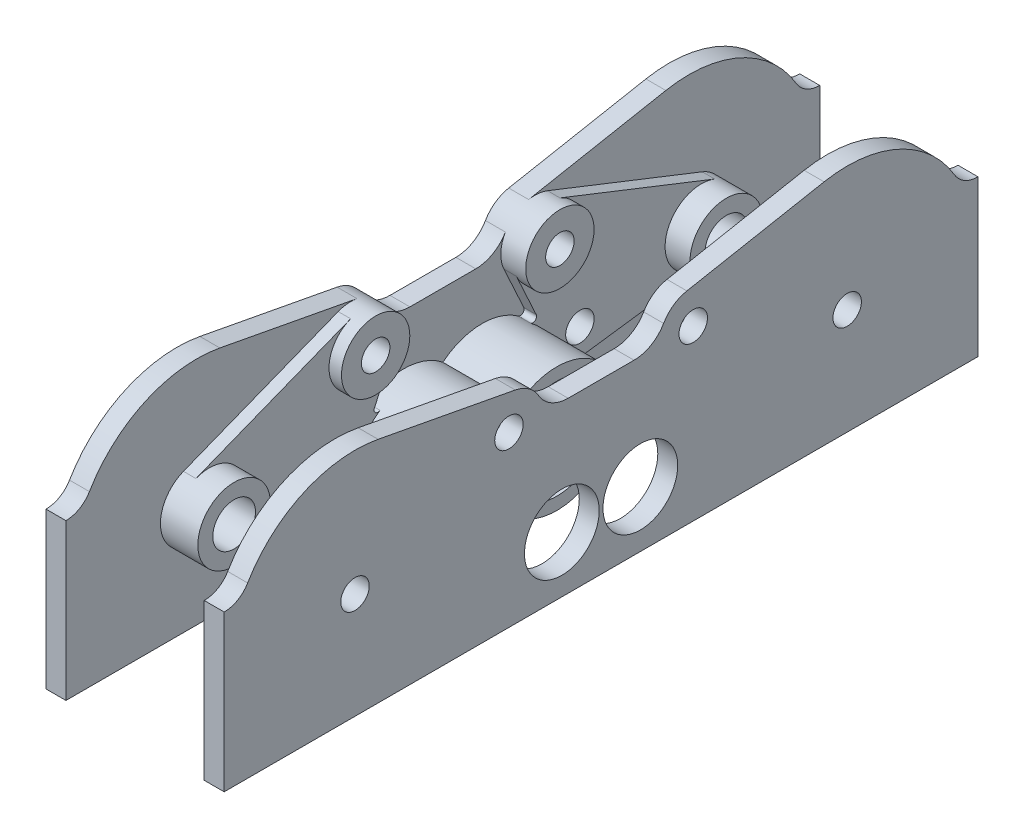
from build123d import *

# Parameters (mm, degrees)
SKETCH1_R                       = 2.286
BOSS_EXTRUDE1_DEPTH             = 3.2
SKETCH4_R                       = 5.486
SKETCH4_R_2                     = 2.286
BOSS_EXTRUDE2_DEPTH             = 4
SKETCH5_R                       = 5.829
SKETCH5_R_2                     = 3.429
EXTRUDE_THIN2_DEPTH             = 6
BOSS_EXTRUDE3_START             = -25.4
BOSS_EXTRUDE3_DEPTH             = 3.2
SKETCH8_R                       = 2.286
CUT_EXTRUDE1_DEPTH              = 106.095956154
EXTRUDE_THIN3_START             = 4
SKETCH9_R                       = 5.286
SKETCH9_R_2                     = 2.286
EXTRUDE_THIN3_DEPTH             = 4
SKETCH10_R                      = 2.286
CUT_EXTRUDE2_DEPTH              = 12
SKETCH13_R                      = 2.286
BOSS_EXTRUDE6_DEPTH             = 2
EXTRUDE_THIN5_DEPTH             = 12
EXTRUDE_THIN5_DIRECTION_2_REACH = 107.096
FILLET2_R                       = 0.6
SKETCH15_R                      = 6
CUT_EXTRUDE3_DEPTH              = 6


with BuildPart() as part:
    # Sketch1 → Boss-Extrude1 (new body)
    with BuildSketch(Plane(origin=(0, 0, 0), x_dir=(0, 0, -1), z_dir=(1, 0, 0))):
        with BuildLine():
            Line((-39.5, 10.1095372), (-39.5, -3.069482786))
            ThreePointArc((-39.5, -3.069482786), (-33.2, 0), (-26.9, -3.069482786))
            Line((-26.9, -3.069482786), (-26.9, -12.930517214))
            ThreePointArc((-26.9, -12.930517214), (-33.2, -16), (-39.5, -12.930517214))
            Line((-39.5, -12.930517214), (-39.5, -17))
            Line((-39.5, -17), (21, -17))
            Line((21, -17), (21, 8))
            ThreePointArc((21, 8), (18.829392145, 8.576436253), (17.230769231, 10.153846154))
            ThreePointArc((17.230769231, 10.153846154), (8.263700567, 18.212941908), (-3.706342027, 19.653575471))
            Line((-3.706342027, 19.653575471), (-25.728736895, 15.500512952))
            ThreePointArc((-25.728736895, 15.500512952), (-27.885324384, 14.584664267), (-29.463102642, 12.8525372))
            ThreePointArc((-29.463102642, 12.8525372), (-31.471118008, 10.844521835), (-34.214118008, 10.1095372))
            Line((-34.214118008, 10.1095372), (-39.5, 10.1095372))
        make_face()
        with Locations((-24.712087277, 10.1095372)):
            Circle(SKETCH1_R, mode=Mode.SUBTRACT)
        Circle(SKETCH1_R, mode=Mode.SUBTRACT)
    extrude(amount=BOSS_EXTRUDE1_DEPTH)

    # Mirror1: part across plane


with BuildPart() as part_1:
    add(part.part)
    add(part.part.mirror(Plane(origin=(3.2, 0, 39.5), x_dir=(1, 0, 0), z_dir=(0, 0, 1))))

    # Sketch4 → Boss-Extrude2 (add)
    # profile 1 of 2: a face of its own
    with BuildSketch(Plane(origin=(3.2, 0, 0), x_dir=(0, 0, -1), z_dir=(1, 0, 0))):
        with Locations((-54.287912723, 10.1095372)):
            Circle(SKETCH4_R)
        with Locations((-54.287912723, 10.1095372)):
            Circle(SKETCH4_R_2, mode=Mode.SUBTRACT)
    # profile 2 of 2: a face of its own
    with BuildSketch(Plane(origin=(3.2, 0, 0), x_dir=(0, 0, -1), z_dir=(1, 0, 0))):
        with Locations(Location((-24.712087277, 10.1095372, 0), (0, 0, 150))):
            Circle(SKETCH4_R)
        with Locations((-24.712087277, 10.1095372)):
            Circle(SKETCH4_R_2, mode=Mode.SUBTRACT)
    extrude(amount=BOSS_EXTRUDE2_DEPTH)

    # Sketch5 → Extrude-Thin2 (add)
    # profile 1 of 2: a face of its own
    with BuildSketch(Plane(origin=(3.2, 0, 0), x_dir=(0, 0, -1), z_dir=(1, 0, 0))):
        with Locations((-79, 0)):
            Circle(SKETCH5_R)
        with Locations((-79, 0)):
            Circle(SKETCH5_R_2, mode=Mode.SUBTRACT)
    # profile 2 of 2: a face of its own
    with BuildSketch(Plane(origin=(3.2, 0, 0), x_dir=(0, 0, -1), z_dir=(1, 0, 0))):
        Circle(SKETCH5_R)
        Circle(SKETCH5_R_2, mode=Mode.SUBTRACT)
    extrude(amount=EXTRUDE_THIN2_DEPTH)

    # Sketch10 → Cut-Extrude2 (cut)
    with BuildSketch(Plane.ZY):
        with Locations((19.5, -4.3)):
            Circle(SKETCH10_R)
        with Locations((59.5, -4.3)):
            Circle(SKETCH10_R)
    extrude(amount=-CUT_EXTRUDE2_DEPTH, mode=Mode.SUBTRACT)

    # Sketch13 → Boss-Extrude6 (add)
    with BuildSketch(Plane(origin=(3.2, 0, 0), x_dir=(0, 0, -1), z_dir=(1, 0, 0))):
        with BuildLine():
            Line((-56.299700955, 15.213349903), (-81.137570836, 5.422917289))
            ThreePointArc((-81.137570836, 5.422917289), (-75.719958796, 4.818565212), (-73.171, 0))
            ThreePointArc((-73.171, 0), (-75.166478454, -4.391053809), (-79.786664284, -5.775673147))
            Line((-79.786664284, -5.775673147), (-60.06681935, -8.461576123))
            ThreePointArc((-60.06681935, -8.461576123), (-57.478432006, -7.981475634), (-55.684260226, -6.055029907))
            Line((-55.684260226, -6.055029907), (-49.30382977, 7.817133851))
            ThreePointArc((-49.30382977, 7.817133851), (-58.273466254, 6.33971505), (-56.299700955, 15.213349903))
        make_face()
        with Locations(Location((-59.5, -4.3, 0), (0, 0, 180))):
            Circle(SKETCH13_R, mode=Mode.SUBTRACT)
    boss_extrude6 = extrude(amount=BOSS_EXTRUDE6_DEPTH)

    # Mirror3: Boss-Extrude6 across plane
    add(boss_extrude6.mirror(Plane(origin=(0, 0, 39.5), x_dir=(1, 0, 0), z_dir=(0, 0, -1))))

    # Sketch14 → Extrude-Thin5 (add)
    with BuildSketch(Plane(origin=(3.2, 0, 0), x_dir=(0, 0, -1), z_dir=(1, 0, 0))):
        with BuildLine():
            ThreePointArc((-39.5, -0.234048674), (-31.717710122, 1.889530662), (-24.9, -2.422366093))
            Line((-24.9, -2.422366093), (-24.9, -13.577633907))
            ThreePointArc((-24.9, -13.577633907), (-31.717710122, -17.889530662), (-39.5, -15.765951326))
            ThreePointArc((-39.5, -15.765951326), (-47.282289878, -17.889530662), (-54.1, -13.577633907))
            Line((-54.1, -13.577633907), (-54.1, -2.422366093))
            ThreePointArc((-54.1, -2.422366093), (-47.282289878, 1.889530662), (-39.5, -0.234048674))
        make_face()
        with BuildLine():
            ThreePointArc((-39.5, -3.069482786), (-33.2, 0), (-26.9, -3.069482786))
            Line((-26.9, -3.069482786), (-26.9, -12.930517214))
            ThreePointArc((-26.9, -12.930517214), (-33.2, -16), (-39.5, -12.930517214))
            ThreePointArc((-39.5, -12.930517214), (-45.8, -16), (-52.1, -12.930517214))
            Line((-52.1, -12.930517214), (-52.1, -3.069482786))
            ThreePointArc((-52.1, -3.069482786), (-45.8, 0), (-39.5, -3.069482786))
        make_face(mode=Mode.SUBTRACT)
    extrude(amount=EXTRUDE_THIN5_DEPTH)

    # Extrude-Thin5 direction 2: up to this face of the body (flat: up to its plane)
    extrude_thin5_direction_2_end = Plane(part_1.part.faces().sort_by_distance((0, 0.243251913, 39.5))[0])
    # Sketch14 → Extrude-Thin5 direction 2 (add, up to the picked face)
    with BuildSketch(Plane(origin=(3.2, 0, 0), x_dir=(0, 0, -1), z_dir=(1, 0, 0)), mode=Mode.PRIVATE) as extrude_thin5_direction_2_sk1:
        with BuildLine():
            ThreePointArc((-39.5, -0.234048674), (-31.717710122, 1.889530662), (-24.9, -2.422366093))
            Line((-24.9, -2.422366093), (-24.9, -13.577633907))
            ThreePointArc((-24.9, -13.577633907), (-31.717710122, -17.889530662), (-39.5, -15.765951326))
            ThreePointArc((-39.5, -15.765951326), (-47.282289878, -17.889530662), (-54.1, -13.577633907))
            Line((-54.1, -13.577633907), (-54.1, -2.422366093))
            ThreePointArc((-54.1, -2.422366093), (-47.282289878, 1.889530662), (-39.5, -0.234048674))
        make_face()
        with BuildLine():
            ThreePointArc((-39.5, -3.069482786), (-33.2, 0), (-26.9, -3.069482786))
            Line((-26.9, -3.069482786), (-26.9, -12.930517214))
            ThreePointArc((-26.9, -12.930517214), (-33.2, -16), (-39.5, -12.930517214))
            ThreePointArc((-39.5, -12.930517214), (-45.8, -16), (-52.1, -12.930517214))
            Line((-52.1, -12.930517214), (-52.1, -3.069482786))
            ThreePointArc((-52.1, -3.069482786), (-45.8, 0), (-39.5, -3.069482786))
        make_face(mode=Mode.SUBTRACT)
    extrude_thin5_direction_2_tool1 = split(extrude(extrude_thin5_direction_2_sk1.sketch, amount=-EXTRUDE_THIN5_DIRECTION_2_REACH, mode=Mode.PRIVATE), bisect_by=extrude_thin5_direction_2_end, keep=Keep.BOTH, mode=Mode.PRIVATE)
    add(extrude_thin5_direction_2_tool1.solids().sort_by(Axis((3.2, 1.539514, 31.770172), (-1, 0, 0)))[0])

    # Fillet2
    fillet2_edges = [part_1.edges().sort_by_distance(p)[0] for p in [
        (4.2, -2.067620911, 53.850271942),
        (4.2, -2.610573073, 54.1),
        (4.2, -2.610573073, 24.9),
        (4.2, -2.067620911, 25.149728058),
    ]]
    fillet(fillet2_edges, radius=FILLET2_R)


with BuildPart() as body_2:
    # Sketch7 → Boss-Extrude3 (new body)
    with BuildSketch(Plane.ZY.offset(BOSS_EXTRUDE3_START)):
        with BuildLine():
            Line((25.728736895, 15.500512952), (3.706342027, 19.653575471))
            ThreePointArc((3.706342027, 19.653575471), (-8.263700567, 18.212941908), (-17.230769231, 10.153846154))
            ThreePointArc((-17.230769231, 10.153846154), (-18.829392145, 8.576436253), (-21, 8))
            Line((-21, 8), (-21, -17))
            Line((-21, -17), (100, -17))
            Line((100, -17), (100, 8))
            ThreePointArc((100, 8), (97.829392145, 8.576436253), (96.230769231, 10.153846154))
            ThreePointArc((96.230769231, 10.153846154), (87.263700567, 18.212941908), (75.293657973, 19.653575471))
            Line((75.293657973, 19.653575471), (53.271263105, 15.500512952))
            ThreePointArc((53.271263105, 15.500512952), (51.114675616, 14.584664267), (49.536897358, 12.8525372))
            ThreePointArc((49.536897358, 12.8525372), (47.528881992, 10.844521835), (44.785881992, 10.1095372))
            Line((44.785881992, 10.1095372), (34.214118008, 10.1095372))
            ThreePointArc((34.214118008, 10.1095372), (31.471118008, 10.844521835), (29.463102642, 12.8525372))
            ThreePointArc((29.463102642, 12.8525372), (27.885324384, 14.584664267), (25.728736895, 15.500512952))
        make_face()
    extrude(amount=-BOSS_EXTRUDE3_DEPTH)

    # Sketch8 → Cut-Extrude1 (cut, through all)
    with BuildSketch(Plane.ZY.offset(-25.4)):
        with Locations((79, 0)):
            Circle(SKETCH8_R)
        with Locations((54.287912723, 10.1095372)):
            Circle(SKETCH8_R)
        with Locations((24.712087277, 10.1095372)):
            Circle(SKETCH8_R)
        Circle(SKETCH8_R)
    extrude(amount=-CUT_EXTRUDE1_DEPTH, mode=Mode.SUBTRACT)

    # Sketch9 → Extrude-Thin3 (add)
    # profile 1 of 2: a face of its own
    with BuildSketch(Plane.ZY.offset(-25.4).offset(EXTRUDE_THIN3_START)):
        with Locations((79, 0)):
            Circle(SKETCH9_R)
        with Locations((79, 0)):
            Circle(SKETCH9_R_2, mode=Mode.SUBTRACT)
    # profile 2 of 2: a face of its own
    with BuildSketch(Plane.ZY.offset(-25.4).offset(EXTRUDE_THIN3_START)):
        Circle(SKETCH9_R)
        Circle(SKETCH9_R_2, mode=Mode.SUBTRACT)
    extrude(amount=-EXTRUDE_THIN3_DEPTH)

    # Sketch15 → Cut-Extrude3 (cut)
    with BuildSketch(Plane(origin=(28.6, 0, 0), x_dir=(0, 0, -1), z_dir=(1, 0, 0))):
        with Locations((-45.8, -8)):
            Circle(SKETCH15_R)
        with Locations((-33.2, -8)):
            Circle(SKETCH15_R)
    extrude(amount=-CUT_EXTRUDE3_DEPTH, mode=Mode.SUBTRACT)


solid = Compound([part_1.part, body_2.part])
